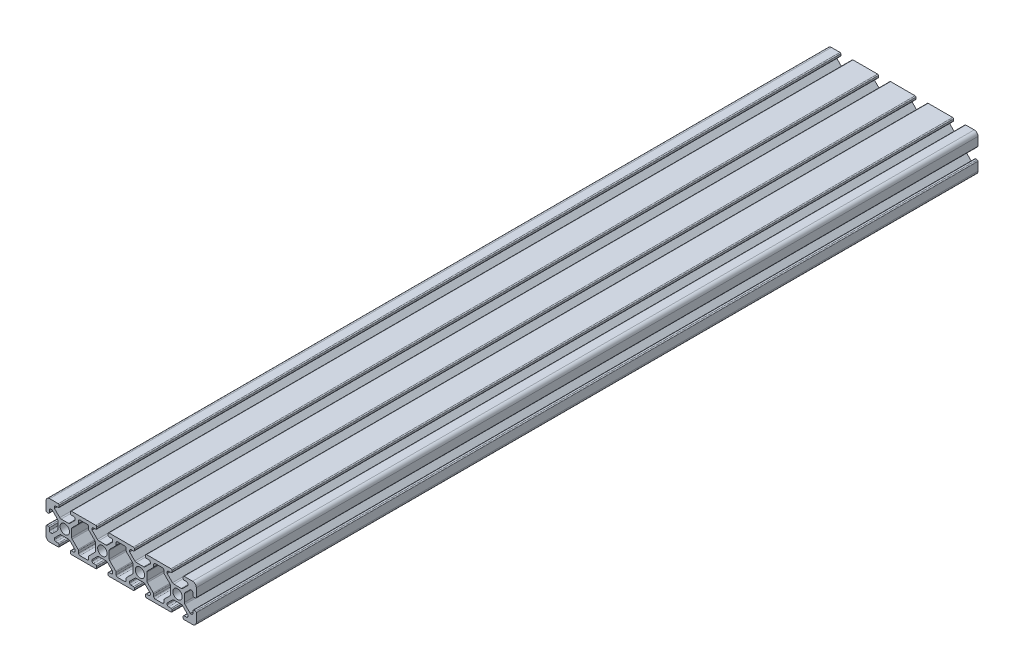
from build123d import *

# Parameters (mm, degrees)
SKETCH1_R           = 2.5
BOSS_EXTRUDE1_DEPTH = 416


with BuildPart() as part:
    # Sketch1 → Boss-Extrude1 (new body)
    with BuildSketch(Plane.XY):
        with BuildLine():
            Line((-41.934956355, 2.341454023), (-37.434956355, 2.341454023))
            ThreePointArc((-37.434956355, 2.341454023), (-37.081402965, 2.487900633), (-36.934956355, 2.841454023))
            Line((-36.934956355, 2.841454023), (-36.934956355, 3.641454023))
            ThreePointArc((-36.934956355, 3.641454023), (-37.081402965, 3.995007414), (-37.434956355, 4.141454023))
            Line((-37.434956355, 4.141454023), (-38.684956355, 4.141454023))
            ThreePointArc((-38.684956355, 4.141454023), (-39.215286441, 4.361123937), (-39.434956355, 4.891454023))
            Line((-39.434956355, 4.891454023), (-39.434956355, 5.568661817))
            Line((-39.434956355, 5.568661817), (-36.605057368, 8.398560804))
            ThreePointArc((-36.605057368, 8.398560804), (-36.280634019, 8.615333556), (-35.897950587, 8.691454023))
            Line((-35.897950587, 8.691454023), (-31.971962124, 8.691454023))
            ThreePointArc((-31.971962124, 8.691454023), (-31.589278691, 8.615333556), (-31.264855343, 8.398560804))
            Line((-31.264855343, 8.398560804), (-28.434956355, 5.568661817))
            Line((-28.434956355, 5.568661817), (-28.434956355, 4.891454023))
            ThreePointArc((-28.434956355, 4.891454023), (-28.654626269, 4.361123937), (-29.184956355, 4.141454023))
            Line((-29.184956355, 4.141454023), (-30.434956355, 4.141454023))
            ThreePointArc((-30.434956355, 4.141454023), (-30.788509746, 3.995007414), (-30.934956355, 3.641454023))
            Line((-30.934956355, 3.641454023), (-30.934956355, 2.841454023))
            ThreePointArc((-30.934956355, 2.841454023), (-30.788509746, 2.487900633), (-30.434956355, 2.341454023))
            Line((-30.434956355, 2.341454023), (-17.434956355, 2.341454023))
            ThreePointArc((-17.434956355, 2.341454023), (-17.081402965, 2.487900633), (-16.934956355, 2.841454023))
            Line((-16.934956355, 2.841454023), (-16.934956355, 3.641454023))
            ThreePointArc((-16.934956355, 3.641454023), (-17.081402965, 3.995007414), (-17.434956355, 4.141454023))
            Line((-17.434956355, 4.141454023), (-18.684956355, 4.141454023))
            ThreePointArc((-18.684956355, 4.141454023), (-19.215286441, 4.361123937), (-19.434956355, 4.891454023))
            Line((-19.434956355, 4.891454023), (-19.434956355, 5.568661817))
            Line((-19.434956355, 5.568661817), (-16.605057368, 8.398560804))
            ThreePointArc((-16.605057368, 8.398560804), (-16.280634019, 8.615333556), (-15.897950587, 8.691454023))
            Line((-15.897950587, 8.691454023), (-11.971962124, 8.691454023))
            ThreePointArc((-11.971962124, 8.691454023), (-11.589278691, 8.615333556), (-11.264855343, 8.398560804))
            Line((-11.264855343, 8.398560804), (-8.434956355, 5.568661817))
            Line((-8.434956355, 5.568661817), (-8.434956355, 4.891454023))
            ThreePointArc((-8.434956355, 4.891454023), (-8.654626269, 4.361123937), (-9.184956355, 4.141454023))
            Line((-9.184956355, 4.141454023), (-10.434956355, 4.141454023))
            ThreePointArc((-10.434956355, 4.141454023), (-10.788509746, 3.995007414), (-10.934956355, 3.641454023))
            Line((-10.934956355, 3.641454023), (-10.934956355, 2.841454023))
            ThreePointArc((-10.934956355, 2.841454023), (-10.788509746, 2.487900633), (-10.434956355, 2.341454023))
            Line((-10.434956355, 2.341454023), (2.565043645, 2.341454023))
            ThreePointArc((2.565043645, 2.341454023), (2.918597035, 2.487900633), (3.065043645, 2.841454023))
            Line((3.065043645, 2.841454023), (3.065043645, 3.641454023))
            ThreePointArc((3.065043645, 3.641454023), (2.918597035, 3.995007414), (2.565043645, 4.141454023))
            Line((2.565043645, 4.141454023), (1.315043645, 4.141454023))
            ThreePointArc((1.315043645, 4.141454023), (0.784713559, 4.361123937), (0.565043645, 4.891454023))
            Line((0.565043645, 4.891454023), (0.565043645, 5.568661817))
            Line((0.565043645, 5.568661817), (3.394942632, 8.398560804))
            ThreePointArc((3.394942632, 8.398560804), (3.719365981, 8.615333556), (4.102049413, 8.691454023))
            Line((4.102049413, 8.691454023), (8.028037876, 8.691454023))
            ThreePointArc((8.028037876, 8.691454023), (8.410721309, 8.615333556), (8.735144657, 8.398560804))
            Line((8.735144657, 8.398560804), (11.565043645, 5.568661817))
            Line((11.565043645, 5.568661817), (11.565043645, 4.891454023))
            ThreePointArc((11.565043645, 4.891454023), (11.345373731, 4.361123937), (10.815043645, 4.141454023))
            Line((10.815043645, 4.141454023), (9.565043645, 4.141454023))
            ThreePointArc((9.565043645, 4.141454023), (9.211490254, 3.995007414), (9.065043645, 3.641454023))
            Line((9.065043645, 3.641454023), (9.065043645, 2.841454023))
            ThreePointArc((9.065043645, 2.841454023), (9.211490254, 2.487900633), (9.565043645, 2.341454023))
            Line((9.565043645, 2.341454023), (22.565043645, 2.341454023))
            ThreePointArc((22.565043645, 2.341454023), (22.918597035, 2.487900633), (23.065043645, 2.841454023))
            Line((23.065043645, 2.841454023), (23.065043645, 3.641454023))
            ThreePointArc((23.065043645, 3.641454023), (22.918597035, 3.995007414), (22.565043645, 4.141454023))
            Line((22.565043645, 4.141454023), (21.315043645, 4.141454023))
            ThreePointArc((21.315043645, 4.141454023), (20.784713559, 4.361123937), (20.565043645, 4.891454023))
            Line((20.565043645, 4.891454023), (20.565043645, 5.568661817))
            Line((20.565043645, 5.568661817), (23.394942632, 8.398560804))
            ThreePointArc((23.394942632, 8.398560804), (23.719365981, 8.615333556), (24.102049413, 8.691454023))
            Line((24.102049413, 8.691454023), (28.028037876, 8.691454023))
            ThreePointArc((28.028037876, 8.691454023), (28.410721309, 8.615333556), (28.735144657, 8.398560804))
            Line((28.735144657, 8.398560804), (31.565043645, 5.568661817))
            Line((31.565043645, 5.568661817), (31.565043645, 4.891454023))
            ThreePointArc((31.565043645, 4.891454023), (31.345373731, 4.361123937), (30.815043645, 4.141454023))
            Line((30.815043645, 4.141454023), (29.565043645, 4.141454023))
            ThreePointArc((29.565043645, 4.141454023), (29.211490254, 3.995007414), (29.065043645, 3.641454023))
            Line((29.065043645, 3.641454023), (29.065043645, 2.841454023))
            ThreePointArc((29.065043645, 2.841454023), (29.211490254, 2.487900633), (29.565043645, 2.341454023))
            Line((29.565043645, 2.341454023), (34.065043645, 2.341454023))
            ThreePointArc((34.065043645, 2.341454023), (35.479257207, 2.927240461), (36.065043645, 4.341454023))
            Line((36.065043645, 4.341454023), (36.065043645, 8.841454023))
            ThreePointArc((36.065043645, 8.841454023), (35.918597035, 9.195007414), (35.565043645, 9.341454023))
            Line((35.565043645, 9.341454023), (34.765043645, 9.341454023))
            ThreePointArc((34.765043645, 9.341454023), (34.411490254, 9.195007414), (34.265043645, 8.841454023))
            Line((34.265043645, 8.841454023), (34.265043645, 7.591454023))
            ThreePointArc((34.265043645, 7.591454023), (34.045373731, 7.061123937), (33.515043645, 6.841454023))
            Line((33.515043645, 6.841454023), (32.837835851, 6.841454023))
            Line((32.837835851, 6.841454023), (30.007936864, 9.671353011))
            ThreePointArc((30.007936864, 9.671353011), (29.791164112, 9.995776359), (29.715043645, 10.378459792))
            Line((29.715043645, 10.378459792), (29.715043645, 14.304448255))
            ThreePointArc((29.715043645, 14.304448255), (29.791164112, 14.687131687), (30.007936864, 15.011555036))
            Line((30.007936864, 15.011555036), (32.837835851, 17.841454023))
            Line((32.837835851, 17.841454023), (33.515043645, 17.841454023))
            ThreePointArc((33.515043645, 17.841454023), (34.045373731, 17.621784109), (34.265043645, 17.091454023))
            Line((34.265043645, 17.091454023), (34.265043645, 15.841454023))
            ThreePointArc((34.265043645, 15.841454023), (34.411490254, 15.487900633), (34.765043645, 15.341454023))
            Line((34.765043645, 15.341454023), (35.565043645, 15.341454023))
            ThreePointArc((35.565043645, 15.341454023), (35.918597035, 15.487900633), (36.065043645, 15.841454023))
            Line((36.065043645, 15.841454023), (36.065043645, 20.341454023))
            ThreePointArc((36.065043645, 20.341454023), (35.479257207, 21.755667586), (34.065043645, 22.341454023))
            Line((34.065043645, 22.341454023), (29.565043645, 22.341454023))
            ThreePointArc((29.565043645, 22.341454023), (29.211490254, 22.195007414), (29.065043645, 21.841454023))
            Line((29.065043645, 21.841454023), (29.065043645, 21.041454023))
            ThreePointArc((29.065043645, 21.041454023), (29.211490254, 20.687900633), (29.565043645, 20.541454023))
            Line((29.565043645, 20.541454023), (30.815043645, 20.541454023))
            ThreePointArc((30.815043645, 20.541454023), (31.345373731, 20.321784109), (31.565043645, 19.791454023))
            Line((31.565043645, 19.791454023), (31.565043645, 19.114246229))
            Line((31.565043645, 19.114246229), (28.735144657, 16.284347242))
            ThreePointArc((28.735144657, 16.284347242), (28.410721309, 16.067574491), (28.028037876, 15.991454023))
            Line((28.028037876, 15.991454023), (24.102049413, 15.991454023))
            ThreePointArc((24.102049413, 15.991454023), (23.719365981, 16.067574491), (23.394942632, 16.284347242))
            Line((23.394942632, 16.284347242), (20.565043645, 19.114246229))
            Line((20.565043645, 19.114246229), (20.565043645, 19.791454023))
            ThreePointArc((20.565043645, 19.791454023), (20.784713559, 20.321784109), (21.315043645, 20.541454023))
            Line((21.315043645, 20.541454023), (22.565043645, 20.541454023))
            ThreePointArc((22.565043645, 20.541454023), (22.918597035, 20.687900633), (23.065043645, 21.041454023))
            Line((23.065043645, 21.041454023), (23.065043645, 21.841454023))
            ThreePointArc((23.065043645, 21.841454023), (22.918597035, 22.195007414), (22.565043645, 22.341454023))
            Line((22.565043645, 22.341454023), (9.565043645, 22.341454023))
            ThreePointArc((9.565043645, 22.341454023), (9.211490254, 22.195007414), (9.065043645, 21.841454023))
            Line((9.065043645, 21.841454023), (9.065043645, 21.041454023))
            ThreePointArc((9.065043645, 21.041454023), (9.211490254, 20.687900633), (9.565043645, 20.541454023))
            Line((9.565043645, 20.541454023), (10.815043645, 20.541454023))
            ThreePointArc((10.815043645, 20.541454023), (11.345373731, 20.321784109), (11.565043645, 19.791454023))
            Line((11.565043645, 19.791454023), (11.565043645, 19.114246229))
            Line((11.565043645, 19.114246229), (8.735144657, 16.284347242))
            ThreePointArc((8.735144657, 16.284347242), (8.410721309, 16.067574491), (8.028037876, 15.991454023))
            Line((8.028037876, 15.991454023), (4.102049413, 15.991454023))
            ThreePointArc((4.102049413, 15.991454023), (3.719365981, 16.067574491), (3.394942632, 16.284347242))
            Line((3.394942632, 16.284347242), (0.565043645, 19.114246229))
            Line((0.565043645, 19.114246229), (0.565043645, 19.791454023))
            ThreePointArc((0.565043645, 19.791454023), (0.784713559, 20.321784109), (1.315043645, 20.541454023))
            Line((1.315043645, 20.541454023), (2.565043645, 20.541454023))
            ThreePointArc((2.565043645, 20.541454023), (2.918597035, 20.687900633), (3.065043645, 21.041454023))
            Line((3.065043645, 21.041454023), (3.065043645, 21.841454023))
            ThreePointArc((3.065043645, 21.841454023), (2.918597035, 22.195007414), (2.565043645, 22.341454023))
            Line((2.565043645, 22.341454023), (-10.434956355, 22.341454023))
            ThreePointArc((-10.434956355, 22.341454023), (-10.788509746, 22.195007414), (-10.934956355, 21.841454023))
            Line((-10.934956355, 21.841454023), (-10.934956355, 21.041454023))
            ThreePointArc((-10.934956355, 21.041454023), (-10.788509746, 20.687900633), (-10.434956355, 20.541454023))
            Line((-10.434956355, 20.541454023), (-9.184956355, 20.541454023))
            ThreePointArc((-9.184956355, 20.541454023), (-8.654626269, 20.321784109), (-8.434956355, 19.791454023))
            Line((-8.434956355, 19.791454023), (-8.434956355, 19.114246229))
            Line((-8.434956355, 19.114246229), (-11.264855343, 16.284347242))
            ThreePointArc((-11.264855343, 16.284347242), (-11.589278691, 16.067574491), (-11.971962124, 15.991454023))
            Line((-11.971962124, 15.991454023), (-15.897950587, 15.991454023))
            ThreePointArc((-15.897950587, 15.991454023), (-16.280634019, 16.067574491), (-16.605057368, 16.284347242))
            Line((-16.605057368, 16.284347242), (-19.434956355, 19.114246229))
            Line((-19.434956355, 19.114246229), (-19.434956355, 19.791454023))
            ThreePointArc((-19.434956355, 19.791454023), (-19.215286441, 20.321784109), (-18.684956355, 20.541454023))
            Line((-18.684956355, 20.541454023), (-17.434956355, 20.541454023))
            ThreePointArc((-17.434956355, 20.541454023), (-17.081402965, 20.687900633), (-16.934956355, 21.041454023))
            Line((-16.934956355, 21.041454023), (-16.934956355, 21.841454023))
            ThreePointArc((-16.934956355, 21.841454023), (-17.081402965, 22.195007414), (-17.434956355, 22.341454023))
            Line((-17.434956355, 22.341454023), (-30.434956355, 22.341454023))
            ThreePointArc((-30.434956355, 22.341454023), (-30.788509746, 22.195007414), (-30.934956355, 21.841454023))
            Line((-30.934956355, 21.841454023), (-30.934956355, 21.041454023))
            ThreePointArc((-30.934956355, 21.041454023), (-30.788509746, 20.687900633), (-30.434956355, 20.541454023))
            Line((-30.434956355, 20.541454023), (-29.184956355, 20.541454023))
            ThreePointArc((-29.184956355, 20.541454023), (-28.654626269, 20.321784109), (-28.434956355, 19.791454023))
            Line((-28.434956355, 19.791454023), (-28.434956355, 19.114246229))
            Line((-28.434956355, 19.114246229), (-31.264855343, 16.284347242))
            ThreePointArc((-31.264855343, 16.284347242), (-31.589278691, 16.067574491), (-31.971962124, 15.991454023))
            Line((-31.971962124, 15.991454023), (-35.897950587, 15.991454023))
            ThreePointArc((-35.897950587, 15.991454023), (-36.280634019, 16.067574491), (-36.605057368, 16.284347242))
            Line((-36.605057368, 16.284347242), (-39.434956355, 19.114246229))
            Line((-39.434956355, 19.114246229), (-39.434956355, 19.791454023))
            ThreePointArc((-39.434956355, 19.791454023), (-39.215286441, 20.321784109), (-38.684956355, 20.541454023))
            Line((-38.684956355, 20.541454023), (-37.434956355, 20.541454023))
            ThreePointArc((-37.434956355, 20.541454023), (-37.081402965, 20.687900633), (-36.934956355, 21.041454023))
            Line((-36.934956355, 21.041454023), (-36.934956355, 21.841454023))
            ThreePointArc((-36.934956355, 21.841454023), (-37.081402965, 22.195007414), (-37.434956355, 22.341454023))
            Line((-37.434956355, 22.341454023), (-41.934956355, 22.341454023))
            ThreePointArc((-41.934956355, 22.341454023), (-43.349169918, 21.755667586), (-43.934956355, 20.341454023))
            Line((-43.934956355, 20.341454023), (-43.934956355, 15.841454023))
            ThreePointArc((-43.934956355, 15.841454023), (-43.788509746, 15.487900633), (-43.434956355, 15.341454023))
            Line((-43.434956355, 15.341454023), (-42.634956355, 15.341454023))
            ThreePointArc((-42.634956355, 15.341454023), (-42.281402965, 15.487900633), (-42.134956355, 15.841454023))
            Line((-42.134956355, 15.841454023), (-42.134956355, 17.091454023))
            ThreePointArc((-42.134956355, 17.091454023), (-41.915286441, 17.621784109), (-41.384956355, 17.841454023))
            Line((-41.384956355, 17.841454023), (-40.707748561, 17.841454023))
            Line((-40.707748561, 17.841454023), (-37.877849574, 15.011555036))
            ThreePointArc((-37.877849574, 15.011555036), (-37.661076823, 14.687131687), (-37.584956355, 14.304448255))
            Line((-37.584956355, 14.304448255), (-37.584956355, 10.378459792))
            ThreePointArc((-37.584956355, 10.378459792), (-37.661076823, 9.995776359), (-37.877849574, 9.671353011))
            Line((-37.877849574, 9.671353011), (-40.707748561, 6.841454023))
            Line((-40.707748561, 6.841454023), (-41.384956355, 6.841454023))
            ThreePointArc((-41.384956355, 6.841454023), (-41.915286441, 7.061123937), (-42.134956355, 7.591454023))
            Line((-42.134956355, 7.591454023), (-42.134956355, 8.841454023))
            ThreePointArc((-42.134956355, 8.841454023), (-42.281402965, 9.195007414), (-42.634956355, 9.341454023))
            Line((-42.634956355, 9.341454023), (-43.434956355, 9.341454023))
            ThreePointArc((-43.434956355, 9.341454023), (-43.788509746, 9.195007414), (-43.934956355, 8.841454023))
            Line((-43.934956355, 8.841454023), (-43.934956355, 4.341454023))
            ThreePointArc((-43.934956355, 4.341454023), (-43.349169918, 2.927240461), (-41.934956355, 2.341454023))
        make_face()
        with Locations(Location((-33.934956355, 12.341454023, 0), (0, 0, 180))):
            Circle(SKETCH1_R, mode=Mode.SUBTRACT)
        with Locations(Location((-13.934956355, 12.341454023, 0), (0, 0, 180))):
            Circle(SKETCH1_R, mode=Mode.SUBTRACT)
        with Locations(Location((6.065043645, 12.341454023, 0), (0, 0, 180))):
            Circle(SKETCH1_R, mode=Mode.SUBTRACT)
        with Locations(Location((26.065043645, 12.341454023, 0), (0, 0, 180))):
            Circle(SKETCH1_R, mode=Mode.SUBTRACT)
        with BuildLine():
            Line((-9.992063136, 15.011555036), (-6.854626269, 18.148991903))
            ThreePointArc((-6.854626269, 18.148991903), (-6.692046706, 18.392309415), (-6.634956355, 18.679321989))
            Line((-6.634956355, 18.679321989), (-6.634956355, 19.791454023))
            ThreePointArc((-6.634956355, 19.791454023), (-6.415286441, 20.321784109), (-5.884956355, 20.541454023))
            Line((-5.884956355, 20.541454023), (-1.984956355, 20.541454023))
            ThreePointArc((-1.984956355, 20.541454023), (-1.454626269, 20.321784109), (-1.234956355, 19.791454023))
            Line((-1.234956355, 19.791454023), (-1.234956355, 18.679321989))
            ThreePointArc((-1.234956355, 18.679321989), (-1.177866005, 18.392309415), (-1.015286441, 18.148991903))
            Line((-1.015286441, 18.148991903), (2.122150426, 15.011555036))
            ThreePointArc((2.122150426, 15.011555036), (2.338923177, 14.687131687), (2.415043645, 14.304448255))
            Line((2.415043645, 14.304448255), (2.415043645, 10.378459792))
            ThreePointArc((2.415043645, 10.378459792), (2.338923177, 9.995776359), (2.122150426, 9.671353011))
            Line((2.122150426, 9.671353011), (-1.015286441, 6.533916144))
            ThreePointArc((-1.015286441, 6.533916144), (-1.177866005, 6.290598632), (-1.234956355, 6.003586058))
            Line((-1.234956355, 6.003586058), (-1.234956355, 4.891454023))
            ThreePointArc((-1.234956355, 4.891454023), (-1.454626269, 4.361123937), (-1.984956355, 4.141454023))
            Line((-1.984956355, 4.141454023), (-5.884956355, 4.141454023))
            ThreePointArc((-5.884956355, 4.141454023), (-6.415286441, 4.361123937), (-6.634956355, 4.891454023))
            Line((-6.634956355, 4.891454023), (-6.634956355, 6.003586058))
            ThreePointArc((-6.634956355, 6.003586058), (-6.692046706, 6.290598632), (-6.854626269, 6.533916144))
            Line((-6.854626269, 6.533916144), (-9.992063136, 9.671353011))
            ThreePointArc((-9.992063136, 9.671353011), (-10.208835888, 9.995776359), (-10.284956355, 10.378459792))
            Line((-10.284956355, 10.378459792), (-10.284956355, 14.304448255))
            ThreePointArc((-10.284956355, 14.304448255), (-10.208835888, 14.687131687), (-9.992063136, 15.011555036))
        make_face(mode=Mode.SUBTRACT)
        with BuildLine():
            Line((-21.015286441, 18.148991903), (-17.877849574, 15.011555036))
            ThreePointArc((-17.877849574, 15.011555036), (-17.661076823, 14.687131687), (-17.584956355, 14.304448255))
            Line((-17.584956355, 14.304448255), (-17.584956355, 10.378459792))
            ThreePointArc((-17.584956355, 10.378459792), (-17.661076823, 9.995776359), (-17.877849574, 9.671353011))
            Line((-17.877849574, 9.671353011), (-21.015286441, 6.533916144))
            ThreePointArc((-21.015286441, 6.533916144), (-21.177866005, 6.290598632), (-21.234956355, 6.003586058))
            Line((-21.234956355, 6.003586058), (-21.234956355, 4.891454023))
            ThreePointArc((-21.234956355, 4.891454023), (-21.454626269, 4.361123937), (-21.984956355, 4.141454023))
            Line((-21.984956355, 4.141454023), (-25.884956355, 4.141454023))
            ThreePointArc((-25.884956355, 4.141454023), (-26.415286441, 4.361123937), (-26.634956355, 4.891454023))
            Line((-26.634956355, 4.891454023), (-26.634956355, 6.003586058))
            ThreePointArc((-26.634956355, 6.003586058), (-26.692046706, 6.290598632), (-26.854626269, 6.533916144))
            Line((-26.854626269, 6.533916144), (-29.992063136, 9.671353011))
            ThreePointArc((-29.992063136, 9.671353011), (-30.208835888, 9.995776359), (-30.284956355, 10.378459792))
            Line((-30.284956355, 10.378459792), (-30.284956355, 14.304448255))
            ThreePointArc((-30.284956355, 14.304448255), (-30.208835888, 14.687131687), (-29.992063136, 15.011555036))
            Line((-29.992063136, 15.011555036), (-26.854626269, 18.148991903))
            ThreePointArc((-26.854626269, 18.148991903), (-26.692046706, 18.392309415), (-26.634956355, 18.679321989))
            Line((-26.634956355, 18.679321989), (-26.634956355, 19.791454023))
            ThreePointArc((-26.634956355, 19.791454023), (-26.415286441, 20.321784109), (-25.884956355, 20.541454023))
            Line((-25.884956355, 20.541454023), (-21.984956355, 20.541454023))
            ThreePointArc((-21.984956355, 20.541454023), (-21.454626269, 20.321784109), (-21.234956355, 19.791454023))
            Line((-21.234956355, 19.791454023), (-21.234956355, 18.679321989))
            ThreePointArc((-21.234956355, 18.679321989), (-21.177866005, 18.392309415), (-21.015286441, 18.148991903))
        make_face(mode=Mode.SUBTRACT)
        with BuildLine():
            Line((18.984713559, 18.148991903), (22.122150426, 15.011555036))
            ThreePointArc((22.122150426, 15.011555036), (22.338923177, 14.687131687), (22.415043645, 14.304448255))
            Line((22.415043645, 14.304448255), (22.415043645, 10.378459792))
            ThreePointArc((22.415043645, 10.378459792), (22.338923177, 9.995776359), (22.122150426, 9.671353011))
            Line((22.122150426, 9.671353011), (18.984713559, 6.533916144))
            ThreePointArc((18.984713559, 6.533916144), (18.822133995, 6.290598632), (18.765043645, 6.003586058))
            Line((18.765043645, 6.003586058), (18.765043645, 4.891454023))
            ThreePointArc((18.765043645, 4.891454023), (18.545373731, 4.361123937), (18.015043645, 4.141454023))
            Line((18.015043645, 4.141454023), (14.115043645, 4.141454023))
            ThreePointArc((14.115043645, 4.141454023), (13.584713559, 4.361123937), (13.365043645, 4.891454023))
            Line((13.365043645, 4.891454023), (13.365043645, 6.003586058))
            ThreePointArc((13.365043645, 6.003586058), (13.307953294, 6.290598632), (13.145373731, 6.533916144))
            Line((13.145373731, 6.533916144), (10.007936864, 9.671353011))
            ThreePointArc((10.007936864, 9.671353011), (9.791164112, 9.995776359), (9.715043645, 10.378459792))
            Line((9.715043645, 10.378459792), (9.715043645, 14.304448255))
            ThreePointArc((9.715043645, 14.304448255), (9.791164112, 14.687131687), (10.007936864, 15.011555036))
            Line((10.007936864, 15.011555036), (13.145373731, 18.148991903))
            ThreePointArc((13.145373731, 18.148991903), (13.307953294, 18.392309415), (13.365043645, 18.679321989))
            Line((13.365043645, 18.679321989), (13.365043645, 19.791454023))
            ThreePointArc((13.365043645, 19.791454023), (13.584713559, 20.321784109), (14.115043645, 20.541454023))
            Line((14.115043645, 20.541454023), (18.015043645, 20.541454023))
            ThreePointArc((18.015043645, 20.541454023), (18.545373731, 20.321784109), (18.765043645, 19.791454023))
            Line((18.765043645, 19.791454023), (18.765043645, 18.679321989))
            ThreePointArc((18.765043645, 18.679321989), (18.822133995, 18.392309415), (18.984713559, 18.148991903))
        make_face(mode=Mode.SUBTRACT)
    extrude(amount=BOSS_EXTRUDE1_DEPTH)


solid = part.part
